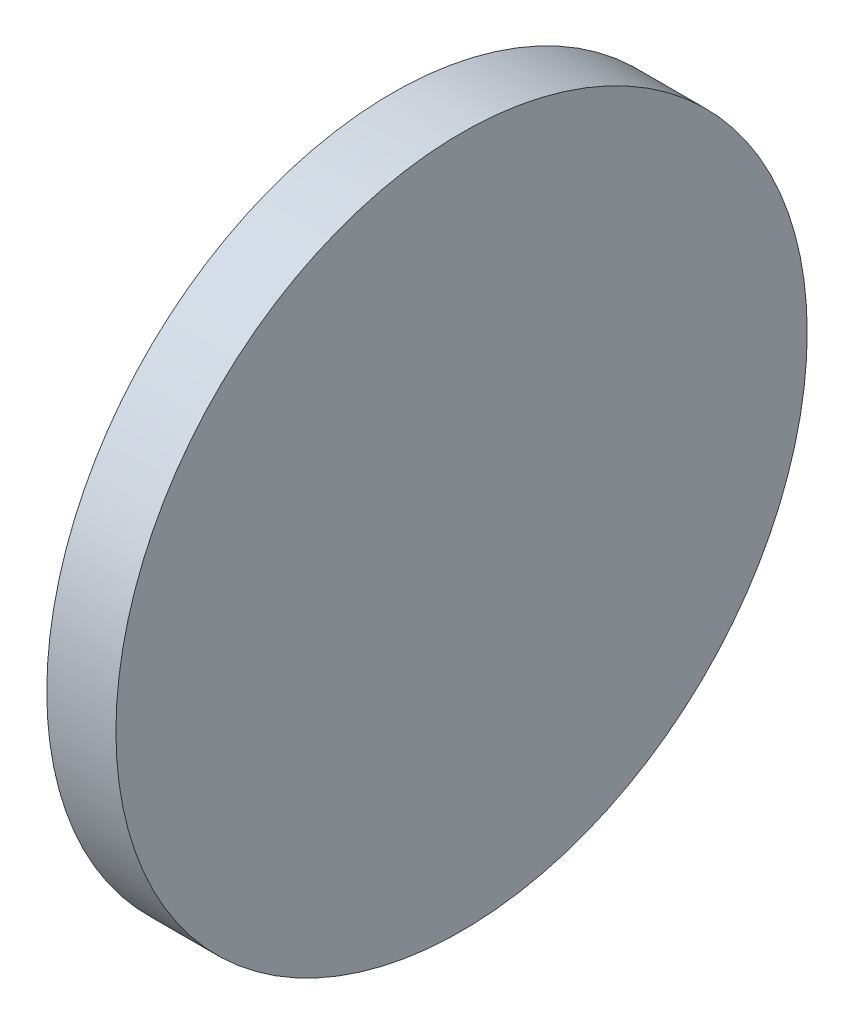
from build123d import *

# Parameters (mm, degrees)
SKETCH1_R           = 100
BOSS_EXTRUDE1_DEPTH = 20
SKETCH4_R           = 1.3
CUT_EXTRUDE2_DEPTH  = 18
BOSS_EXTRUDE3_START = 10
SKETCH5_R           = 5
SKETCH5_R_2         = 1.3
BOSS_EXTRUDE3_DEPTH = 10


with BuildPart() as part:
    # Sketch1 → Boss-Extrude1 (new body)
    with BuildSketch(Plane(origin=(0, 0, 0), x_dir=(0, 0, -1), z_dir=(1, 0, 0))):
        Circle(SKETCH1_R)
    extrude(amount=BOSS_EXTRUDE1_DEPTH)

    # Sketch4 → Cut-Extrude2 (cut)
    with BuildSketch(Plane.ZY):
        with Locations((0, 65)):
            Circle(SKETCH4_R)
        with Locations((45.961940777, 45.961940777)):
            Circle(SKETCH4_R)
        with Locations((65, 0)):
            Circle(SKETCH4_R)
        with Locations((45.961940777, -45.961940777)):
            Circle(SKETCH4_R)
        with Locations((0, -65)):
            Circle(SKETCH4_R)
        with Locations((-45.961940777, -45.961940777)):
            Circle(SKETCH4_R)
        with Locations((-65, 0)):
            Circle(SKETCH4_R)
        with Locations((-45.961940777, 45.961940777)):
            Circle(SKETCH4_R)
    extrude(amount=-CUT_EXTRUDE2_DEPTH, mode=Mode.SUBTRACT)

    # Sketch5 → Boss-Extrude3 (add)
    # profile 1 of 8: a face of its own
    with BuildSketch(Plane.ZY.offset(BOSS_EXTRUDE3_START)):
        with Locations(Location((0, 65, 0), (0, 0, 180))):
            Circle(SKETCH5_R)
        with Locations((0, 65)):
            Circle(SKETCH5_R_2, mode=Mode.SUBTRACT)
    # profile 2 of 8: a face of its own
    with BuildSketch(Plane.ZY.offset(BOSS_EXTRUDE3_START)):
        with Locations(Location((45.961940777, 45.961940777, 0), (0, 0, 180))):
            Circle(SKETCH5_R)
        with Locations((45.961940777, 45.961940777)):
            Circle(SKETCH5_R_2, mode=Mode.SUBTRACT)
    # profile 3 of 8: a face of its own
    with BuildSketch(Plane.ZY.offset(BOSS_EXTRUDE3_START)):
        with Locations(Location((65, 0, 0), (0, 0, 180))):
            Circle(SKETCH5_R)
        with Locations((65, 0)):
            Circle(SKETCH5_R_2, mode=Mode.SUBTRACT)
    # profile 4 of 8: a face of its own
    with BuildSketch(Plane.ZY.offset(BOSS_EXTRUDE3_START)):
        with Locations(Location((45.961940777, -45.961940777, 0), (0, 0, 180))):
            Circle(SKETCH5_R)
        with Locations((45.961940777, -45.961940777)):
            Circle(SKETCH5_R_2, mode=Mode.SUBTRACT)
    # profile 5 of 8: a face of its own
    with BuildSketch(Plane.ZY.offset(BOSS_EXTRUDE3_START)):
        with Locations(Location((0, -65, 0), (0, 0, 180))):
            Circle(SKETCH5_R)
        with Locations((0, -65)):
            Circle(SKETCH5_R_2, mode=Mode.SUBTRACT)
    # profile 6 of 8: a face of its own
    with BuildSketch(Plane.ZY.offset(BOSS_EXTRUDE3_START)):
        with Locations(Location((-45.961940777, -45.961940777, 0), (0, 0, 180))):
            Circle(SKETCH5_R)
        with Locations((-45.961940777, -45.961940777)):
            Circle(SKETCH5_R_2, mode=Mode.SUBTRACT)
    # profile 7 of 8: a face of its own
    with BuildSketch(Plane.ZY.offset(BOSS_EXTRUDE3_START)):
        with Locations(Location((-65, 0, 0), (0, 0, 180))):
            Circle(SKETCH5_R)
        with Locations((-65, 0)):
            Circle(SKETCH5_R_2, mode=Mode.SUBTRACT)
    # profile 8 of 8: a face of its own
    with BuildSketch(Plane.ZY.offset(BOSS_EXTRUDE3_START)):
        with Locations(Location((-45.961940777, 45.961940777, 0), (0, 0, 180))):
            Circle(SKETCH5_R)
        with Locations((-45.961940777, 45.961940777)):
            Circle(SKETCH5_R_2, mode=Mode.SUBTRACT)
    extrude(amount=-BOSS_EXTRUDE3_DEPTH)


solid = part.part
